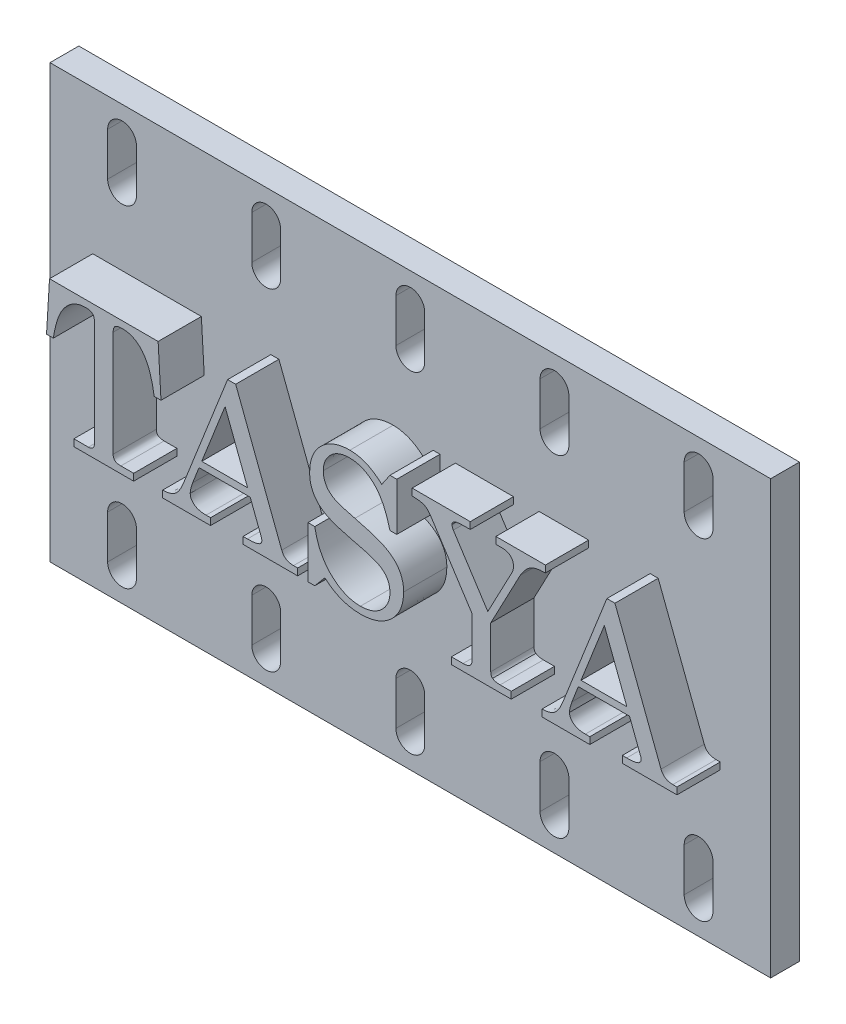
from build123d import *

# Parameters (mm, degrees)
BOSS_EXTRUDE1_DEPTH   = 5
BOSS_EXTRUDE1_2_DEPTH = 5
BOSS_EXTRUDE1_3_DEPTH = 5
BOSS_EXTRUDE1_4_DEPTH = 5
BOSS_EXTRUDE1_5_DEPTH = 5
SKETCH2_W             = 40
SKETCH2_H             = 30
SKETCH2_W_2           = 10
BOSS_EXTRUDE3_DEPTH   = 2


with BuildPart() as part:
    # Sketch1 → Boss-Extrude1 (new body)
    with BuildSketch(Plane.XY):
        with BuildLine():
            Line((0.563054481, 9.245947266), (8.097612469, 9.245947266))
            Line((8.097612469, 9.245947266), (8.297644982, 5.808351487))
            Line((8.297644982, 5.808351487), (7.82349384, 5.808351487))
            add(Edge.make_bspline(
                [(7.82349384, 5.808351487), (7.804678657, 5.928288889), (7.768184964, 6.160917972), (7.699525761, 6.497208977), (7.620929031, 6.810341913), (7.529276483, 7.099839675), (7.431316985, 7.367878699), (7.316901119, 7.61068071), (7.196164252, 7.832600129), (7.061512974, 8.029360895), (6.919724607, 8.206165501), (6.762593818, 8.355927576), (6.597562097, 8.4859884), (6.419534153, 8.589999112), (6.231530974, 8.672863723), (6.031936665, 8.729143406), (5.822705035, 8.766346551), (5.67948398, 8.769955966), (5.606466822, 8.771796124)],
                knots=[0, 0, 0, 0, 1.432451823, 2.778365615, 4.048814831, 5.240071754, 6.360497384, 7.41327137, 8.404638267, 9.338184166, 10.223433942, 11.073572704, 11.894005427, 12.697408972, 13.500019358, 14.311606187, 15.139220712, 16, 16, 16, 16], degree=3))
            add(Edge.make_bspline(
                [(5.606466822, 8.771796124), (5.551422442, 8.770775717), (5.449348164, 8.768883474), (5.309962879, 8.745657082), (5.197450782, 8.707931543), (5.109237715, 8.65324224), (5.04974781, 8.574384523), (5.006694504, 8.480445681), (4.983843545, 8.365344776), (4.980430993, 8.282916807), (4.978586989, 8.238376089)],
                knots=[0, 0, 0, 0, 1.373378458, 2.546792513, 3.512211499, 4.324574211, 5.092577234, 5.940998757, 6.88739958, 8, 8, 8, 8], degree=3))
            Line((4.978586989, 8.238376089), (4.978586989, 0.90755492))
            add(Edge.make_bspline(
                [(4.978586989, 0.90755492), (4.979584666, 0.87278867), (4.98146605, 0.807227662), (5.006700455, 0.716091594), (5.044666171, 0.638311598), (5.101751243, 0.575510306), (5.177731374, 0.528011848), (5.272770682, 0.496116679), (5.387268826, 0.478447341), (5.469340404, 0.475662011), (5.513859177, 0.474151142)],
                knots=[0, 0, 0, 0, 1.048245625, 1.976745847, 2.836833363, 3.643156965, 4.508094636, 5.517888877, 6.65360768, 8, 8, 8, 8], degree=3))
            Line((5.513859177, 0.474151142), (6.401040415, 0.474151142))
            Line((6.401040415, 0.474151142), (6.401040415, 0))
            Line((6.401040415, 0), (2.252217924, 0))
            Line((2.252217924, 0), (2.252217924, 0.474151142))
            Line((2.252217924, 0.474151142), (3.2597891, 0.474151142))
            add(Edge.make_bspline(
                [(3.2597891, 0.474151142), (3.291333974, 0.47581063), (3.351304235, 0.4789655), (3.436297414, 0.496064778), (3.508591021, 0.530665008), (3.569220959, 0.577139462), (3.614894413, 0.636186437), (3.652644955, 0.701331748), (3.669716188, 0.778343224), (3.672970092, 0.831570061), (3.674671349, 0.859398945)],
                knots=[0, 0, 0, 0, 1.182923075, 2.248866389, 3.221156285, 4.16015494, 5.08104171, 6.001928481, 6.955337164, 8, 8, 8, 8], degree=3))
            Line((3.674671349, 0.859398945), (3.674671349, 8.293940676))
            add(Edge.make_bspline(
                [(3.674671349, 8.293940676), (3.672887573, 8.331111829), (3.669508339, 8.401529872), (3.64437435, 8.501200162), (3.596476834, 8.584512438), (3.530886504, 8.654287232), (3.444955314, 8.708329401), (3.337982474, 8.747558728), (3.209319337, 8.76801486), (3.116621228, 8.770480606), (3.067165199, 8.771796124)],
                knots=[0, 0, 0, 0, 1.008377174, 1.910297138, 2.757863652, 3.587197201, 4.483814459, 5.485493234, 6.658467561, 8, 8, 8, 8], degree=3))
            add(Edge.make_bspline(
                [(3.067165199, 8.771796124), (2.992909126, 8.769375509), (2.846436994, 8.764600779), (2.631605136, 8.724507676), (2.426756058, 8.658910026), (2.229653173, 8.570067977), (2.044583616, 8.451254369), (1.866527989, 8.310246982), (1.701725931, 8.139513399), (1.601639785, 8.01269909), (1.550251975, 7.947588084)],
                knots=[0, 0, 0, 0, 0.991941037, 1.9566308, 2.909208852, 3.861929869, 4.837255463, 5.841206404, 6.891598091, 8, 8, 8, 8], degree=3))
            add(Edge.make_bspline(
                [(1.550251975, 7.947588084), (1.509077834, 7.887742158), (1.423557288, 7.763439472), (1.311171305, 7.55614498), (1.208096281, 7.3242563), (1.114033616, 7.067941852), (1.02906113, 6.787732222), (0.95425462, 6.483244295), (0.884639618, 6.154856125), (0.848469469, 5.926462556), (0.829764498, 5.808351487)],
                knots=[0, 0, 0, 0, 0.765022806, 1.588986829, 2.480046904, 3.437147945, 4.464044908, 5.563778044, 6.740136255, 8, 8, 8, 8], degree=3))
            Line((0.829764498, 5.808351487), (0.355613356, 5.808351487))
            Line((0.355613356, 5.808351487), (0.563054481, 9.245947266))
        make_face()
    extrude(amount=BOSS_EXTRUDE1_DEPTH)



with BuildPart() as body_2:
    # Sketch1 → Boss-Extrude1 2 (new body)
    with BuildSketch(Plane.XY):
        with BuildLine():
            Line((12.918766462, 9.364485051), (13.478116637, 9.364485051))
            Line((13.478116637, 9.364485051), (16.674932539, 0.992753953))
            add(Edge.make_bspline(
                [(16.674932539, 0.992753953), (16.692816406, 0.951346792), (16.727162006, 0.871825191), (16.798308338, 0.76529358), (16.880676758, 0.673468244), (16.979576467, 0.601464322), (17.088170253, 0.541206615), (17.212876463, 0.505101948), (17.348453682, 0.476659883), (17.444017206, 0.475007961), (17.493584119, 0.474151142)],
                knots=[0, 0, 0, 0, 1.039787226, 1.996889935, 2.945563617, 3.872445737, 4.810232727, 5.797866669, 6.857796924, 8, 8, 8, 8], degree=3))
            Line((17.493584119, 0.474151142), (17.780667819, 0.474151142))
            Line((17.780667819, 0.474151142), (17.780667819, 0))
            Line((17.780667819, 0), (13.987458684, 0))
            Line((13.987458684, 0), (13.987458684, 0.474151142))
            Line((13.987458684, 0.474151142), (14.289359606, 0.474151142))
            add(Edge.make_bspline(
                [(14.289359606, 0.474151142), (14.380842109, 0.475039176), (14.549978611, 0.47668101), (14.781309811, 0.501271302), (14.972466378, 0.534769329), (15.078899198, 0.579899665), (15.126532716, 0.600097539)],
                knots=[0, 0, 0, 0, 1.28614417, 2.377874675, 3.274025287, 4, 4, 4, 4], degree=3))
            add(Edge.make_bspline(
                [(15.126532716, 0.600097539), (15.151529903, 0.615553505), (15.200076981, 0.645570564), (15.256062281, 0.709776258), (15.286565121, 0.788460965), (15.290951955, 0.843715292), (15.293226477, 0.872364015)],
                knots=[0, 0, 0, 0, 1.044845995, 2.029197152, 2.978161746, 4, 4, 4, 4], degree=3))
            add(Edge.make_bspline(
                [(15.293226477, 0.872364015), (15.291206535, 0.90974201), (15.286982294, 0.987909472), (15.260658814, 1.061682477), (15.246922654, 1.100178821)],
                knots=[0, 0, 0, 0, 0.9563569, 2, 2, 2, 2], degree=3))
            Line((15.246922654, 1.100178821), (14.487539966, 3.081982422))
            Line((14.487539966, 3.081982422), (10.936962861, 3.081982422))
            Line((10.936962861, 3.081982422), (10.490594013, 1.944760543))
            add(Edge.make_bspline(
                [(10.490594013, 1.944760543), (10.465604863, 1.87342624), (10.418820652, 1.739875513), (10.366585704, 1.54819676), (10.332269029, 1.379822279), (10.32652917, 1.274406703), (10.323900252, 1.226125218)],
                knots=[0, 0, 0, 0, 1.224040328, 2.291625076, 3.217545626, 4, 4, 4, 4], degree=3))
            add(Edge.make_bspline(
                [(10.323900252, 1.226125218), (10.327569672, 1.175652974), (10.334796345, 1.076251309), (10.390182519, 0.933093845), (10.48233579, 0.804616072), (10.605479898, 0.68621891), (10.765051719, 0.589693692), (10.958064524, 0.52283246), (11.181360639, 0.47917018), (11.341115014, 0.475891726), (11.425931226, 0.474151142)],
                knots=[0, 0, 0, 0, 0.81354721, 1.602226087, 2.440081589, 3.349586742, 4.342853265, 5.424428202, 6.632586778, 8, 8, 8, 8], degree=3))
            Line((11.425931226, 0.474151142), (11.73524076, 0.474151142))
            Line((11.73524076, 0.474151142), (11.73524076, 0))
            Line((11.73524076, 0), (8.416182767, 0))
            Line((8.416182767, 0), (8.416182767, 0.474151142))
            add(Edge.make_bspline(
                [(8.416182767, 0.474151142), (8.502216342, 0.476678872), (8.666294475, 0.481499609), (8.898712724, 0.526244937), (9.103803578, 0.599287443), (9.284934005, 0.707490069), (9.446987224, 0.859943749), (9.591857232, 1.064419414), (9.73657869, 1.316731177), (9.816222342, 1.508400909), (9.859009875, 1.611373021)],
                knots=[0, 0, 0, 0, 1.036060294, 1.975912788, 2.839911673, 3.647735987, 4.500737518, 5.500873586, 6.657376306, 8, 8, 8, 8], degree=3))
            Line((9.859009875, 1.611373021), (12.918766462, 9.364485051))
        make_face()
        Polygon((12.742811937, 7.656800079), (11.124030304, 3.556133564), (14.306028982, 3.556133564), align=None, mode=Mode.SUBTRACT)
    extrude(amount=BOSS_EXTRUDE1_2_DEPTH)


with BuildPart() as body_3:
    # Sketch1 → Boss-Extrude1 3 (new body)
    with BuildSketch(Plane.XY):
        with BuildLine():
            Line((23.614949446, 8.416182767), (24.181708233, 9.245947266))
            Line((24.181708233, 9.245947266), (24.655859375, 9.245947266))
            Line((24.655859375, 9.245947266), (24.655859375, 5.926889273))
            Line((24.655859375, 5.926889273), (24.181708233, 5.926889273))
            add(Edge.make_bspline(
                [(24.181708233, 5.926889273), (24.149549446, 6.051313411), (24.086898319, 6.293714109), (23.976066142, 6.641338116), (23.853931269, 6.963011493), (23.720908877, 7.258406813), (23.576468011, 7.52785254), (23.421255834, 7.772361036), (23.25224955, 7.98916577), (23.073905752, 8.181558926), (22.885765585, 8.348472793), (22.691494244, 8.494503936), (22.487960952, 8.614433236), (22.279884109, 8.716079365), (22.063769589, 8.794150511), (21.840370034, 8.849667598), (21.610135525, 8.884042204), (21.454222126, 8.888226497), (21.375696593, 8.890333909)],
                knots=[0, 0, 0, 0, 1.392564724, 2.712967664, 3.951873449, 5.119722724, 6.221370984, 7.262600271, 8.254348041, 9.196438926, 10.101595302, 10.976777585, 11.825919055, 12.65785703, 13.483312273, 14.310934069, 15.149304651, 16, 16, 16, 16], degree=3))
            add(Edge.make_bspline(
                [(21.375696593, 8.890333909), (21.310818969, 8.888892428), (21.183141876, 8.886055638), (20.996285608, 8.864319488), (20.818603967, 8.824546884), (20.649717038, 8.771272175), (20.489688263, 8.702329108), (20.338230058, 8.61890302), (20.197368306, 8.517951672), (20.066405298, 8.403874925), (19.948972535, 8.278298108), (19.844174946, 8.146191526), (19.754622938, 8.007902937), (19.683965702, 7.86123418), (19.628087802, 7.708612396), (19.587334927, 7.549251878), (19.562380201, 7.38285588), (19.559963627, 7.269787787), (19.5587346, 7.212283384)],
                knots=[0, 0, 0, 0, 1.126750777, 2.217409579, 3.260704063, 4.284866151, 5.288787342, 6.282404548, 7.282136379, 8.292906458, 9.294247238, 10.263909872, 11.218754854, 12.149141496, 13.085441672, 14.037331684, 15.001822113, 16, 16, 16, 16], degree=3))
            add(Edge.make_bspline(
                [(19.5587346, 7.212283384), (19.560338986, 7.141079707), (19.563459938, 7.002569821), (19.603170347, 6.801969165), (19.660893552, 6.613771619), (19.745402063, 6.439709686), (19.853314318, 6.280563624), (19.987771364, 6.138545977), (20.14370181, 6.010668326), (20.293478654, 5.916679454), (20.432819374, 5.849180042), (20.559515408, 5.795363538), (20.70752379, 5.740722512), (20.87578847, 5.682793566), (21.065603734, 5.626888572), (21.274754603, 5.564261273), (21.506224141, 5.504399577), (21.667686163, 5.464325253), (21.751683631, 5.443477367)],
                knots=[0, 0, 0, 0, 1.100069853, 2.139925311, 3.152029683, 4.138980986, 5.121994753, 6.115535174, 7.15398554, 8.235440347, 8.84210157, 9.54830075, 10.364495047, 11.282859591, 12.301255968, 13.425815379, 14.660830642, 16, 16, 16, 16], degree=3))
            add(Edge.make_bspline(
                [(21.751683631, 5.443477367), (21.870292144, 5.413504481), (22.099251553, 5.355645446), (22.428777974, 5.267580529), (22.731863344, 5.178206836), (23.00859859, 5.090084094), (23.259712825, 5.002338594), (23.485398177, 4.918677374), (23.684586716, 4.833606349), (23.910566111, 4.721489514), (24.161142465, 4.576128058), (24.421474284, 4.373746219), (24.643253834, 4.151345151), (24.820861216, 3.903380658), (24.959356189, 3.634935073), (25.061005649, 3.345562017), (25.117978365, 3.03234719), (25.125927824, 2.81673152), (25.130010517, 2.705995384)],
                knots=[0, 0, 0, 0, 1.232165093, 2.378545896, 3.435149422, 4.414474693, 5.303353997, 6.114110724, 6.838339871, 7.483508315, 8.654450536, 9.749016275, 10.7955263, 11.806804694, 12.808015395, 13.828656267, 14.884838868, 16, 16, 16, 16], degree=3))
            add(Edge.make_bspline(
                [(25.130010517, 2.705995384), (25.127635891, 2.606458627), (25.122971026, 2.410922361), (25.082777985, 2.124410697), (25.01907061, 1.850175585), (24.924816854, 1.590305684), (24.80868548, 1.341419907), (24.662378204, 1.10810057), (24.493223766, 0.885470899), (24.297753378, 0.67987925), (24.08170221, 0.493327418), (23.849063451, 0.329501154), (23.601863707, 0.18972636), (23.338710279, 0.075818658), (23.059577717, -0.010414045), (22.765924515, -0.073729015), (22.457074502, -0.110937569), (22.246309011, -0.115970271), (22.138783587, -0.118537785)],
                knots=[0, 0, 0, 0, 1.035674451, 2.034544032, 3.00567608, 3.961072093, 4.906865893, 5.859230957, 6.821991021, 7.813035652, 8.806369794, 9.78881277, 10.770098954, 11.757427494, 12.767644959, 13.806306077, 14.880851562, 16, 16, 16, 16], degree=3))
            add(Edge.make_bspline(
                [(22.138783587, -0.118537785), (22.021945604, -0.115814077), (21.791724477, -0.110447199), (21.452063176, -0.064101218), (21.124320046, 0.008701429), (20.808398165, 0.114166107), (20.504014556, 0.2470689), (20.211972029, 0.411885647), (19.930264259, 0.604339511), (19.756189048, 0.753969664), (19.668011621, 0.829764498)],
                knots=[0, 0, 0, 0, 1.034489663, 2.038389989, 3.030740084, 4.004349409, 4.983823211, 5.968063708, 6.970727015, 8, 8, 8, 8], degree=3))
            Line((19.668011621, 0.829764498), (18.966045673, 0))
            Line((18.966045673, 0), (18.491894531, 0))
            Line((18.491894531, 0), (18.491894531, 3.556133564))
            Line((18.491894531, 3.556133564), (18.966045673, 3.556133564))
            add(Edge.make_bspline(
                [(18.966045673, 3.556133564), (18.988950223, 3.435333902), (19.033824649, 3.198664097), (19.130286233, 2.857050395), (19.241769563, 2.532862623), (19.377645142, 2.229334555), (19.531403711, 1.944863159), (19.704283433, 1.67934409), (19.899167407, 1.435136421), (20.112008489, 1.211074679), (20.338109476, 1.010988087), (20.572185926, 0.835095404), (20.814739316, 0.687372795), (21.064632713, 0.567850293), (21.320559637, 0.470751953), (21.584886047, 0.405394706), (21.855848082, 0.362438537), (22.039220458, 0.357896151), (22.131374975, 0.355613356)],
                knots=[0, 0, 0, 0, 1.203557391, 2.358000753, 3.472814881, 4.558186921, 5.610607053, 6.636911962, 7.656713516, 8.666011679, 9.659686897, 10.610151865, 11.529909132, 12.435830157, 13.319692086, 14.205413257, 15.098123285, 16, 16, 16, 16], degree=3))
            add(Edge.make_bspline(
                [(22.131374975, 0.355613356), (22.204895348, 0.357686079), (22.349240977, 0.361755541), (22.560867965, 0.385013118), (22.762191003, 0.428284581), (22.953278345, 0.487325132), (23.134641819, 0.562882689), (23.303176375, 0.659190806), (23.464339311, 0.767773875), (23.610631342, 0.895558005), (23.743618451, 1.033995108), (23.861327203, 1.18022388), (23.95975783, 1.335322064), (24.042168201, 1.496782917), (24.10542087, 1.666458676), (24.149697884, 1.84288149), (24.176228238, 2.026686057), (24.179856874, 2.151495904), (24.181708233, 2.215174866)],
                knots=[0, 0, 0, 0, 1.141184085, 2.24053454, 3.298523207, 4.331930668, 5.340931447, 6.340425213, 7.339689331, 8.351914852, 9.348050511, 10.316191482, 11.259745609, 12.193863714, 13.124634419, 14.063457944, 15.01196107, 16, 16, 16, 16], degree=3))
            add(Edge.make_bspline(
                [(24.181708233, 2.215174866), (24.179312846, 2.286350324), (24.174629979, 2.425494919), (24.135117648, 2.627896683), (24.068144239, 2.816353683), (23.974127308, 2.991431475), (23.852302737, 3.152518278), (23.699587737, 3.299262508), (23.513696211, 3.427668366), (23.335610815, 3.52473323), (23.168481925, 3.59989283), (23.012391396, 3.658470983), (22.829005392, 3.718541837), (22.618595512, 3.783892967), (22.380871958, 3.851910766), (22.114528609, 3.922094349), (21.821396532, 3.996184081), (21.615939651, 4.044199897), (21.509051602, 4.069179916)],
                knots=[0, 0, 0, 0, 0.958725222, 1.874261679, 2.766509533, 3.645150004, 4.542196588, 5.477931134, 6.486874257, 7.578017349, 8.207475951, 8.95547135, 9.823846098, 10.80822927, 11.924964205, 13.156213188, 14.52053228, 16, 16, 16, 16], degree=3))
            add(Edge.make_bspline(
                [(21.509051602, 4.069179916), (21.39097436, 4.098206562), (21.163360847, 4.154160247), (20.836449388, 4.244952999), (20.53648267, 4.338490912), (20.264295775, 4.436911894), (20.018682806, 4.535750654), (19.802046187, 4.639837522), (19.610602823, 4.744040542), (19.497626276, 4.822661563), (19.443901121, 4.860049204)],
                knots=[0, 0, 0, 0, 1.311989861, 2.529078561, 3.660524616, 4.701531557, 5.651641921, 6.51576602, 7.294183583, 8, 8, 8, 8], degree=3))
            add(Edge.make_bspline(
                [(19.443901121, 4.860049204), (19.377723779, 4.913497057), (19.246920687, 5.019139626), (19.076603944, 5.201691173), (18.93121092, 5.400195845), (18.815493896, 5.616749193), (18.720852388, 5.847661374), (18.657280396, 6.096364698), (18.617303896, 6.360841816), (18.612761977, 6.542887949), (18.610432317, 6.636263833)],
                knots=[0, 0, 0, 0, 1.000126293, 1.976803651, 2.928762077, 3.887903112, 4.859377268, 5.858658592, 6.90165398, 8, 8, 8, 8], degree=3))
            add(Edge.make_bspline(
                [(18.610432317, 6.636263833), (18.613176371, 6.733904921), (18.618560996, 6.925504872), (18.653334434, 7.206104239), (18.714821263, 7.473603328), (18.801816216, 7.726569659), (18.912147344, 7.967144289), (19.047490954, 8.193244556), (19.208377824, 8.405567047), (19.391035194, 8.603250202), (19.593606802, 8.781658934), (19.811265136, 8.938211929), (20.042541471, 9.070979292), (20.288026859, 9.178239051), (20.547304163, 9.262446022), (20.820533113, 9.320173935), (21.106613312, 9.359480525), (21.302090691, 9.362796549), (21.401626734, 9.364485051)],
                knots=[0, 0, 0, 0, 1.070268323, 2.100174846, 3.093319402, 4.073467769, 5.027260625, 5.989371598, 6.955733259, 7.942215445, 8.934691163, 9.909381139, 10.876334984, 11.8520346, 12.840742565, 13.858820071, 14.909722553, 16, 16, 16, 16], degree=3))
            add(Edge.make_bspline(
                [(21.401626734, 9.364485051), (21.498705755, 9.362211753), (21.690657213, 9.357716827), (21.974821865, 9.315106006), (22.251582377, 9.246795345), (22.523711967, 9.149358581), (22.793673969, 9.0186928), (23.06722736, 8.855034263), (23.343148462, 8.651353383), (23.5221539, 8.496472343), (23.614949446, 8.416182767)],
                knots=[0, 0, 0, 0, 0.943425551, 1.865407251, 2.787037101, 3.711770321, 4.670334693, 5.698831597, 6.80708552, 8, 8, 8, 8], degree=3))
        make_face()
    extrude(amount=BOSS_EXTRUDE1_3_DEPTH)


with BuildPart() as body_4:
    # Sketch1 → Boss-Extrude1 4 (new body)
    with BuildSketch(Plane.XY):
        with BuildLine():
            Line((25.722699444, 9.245947266), (29.75298415, 9.245947266))
            Line((29.75298415, 9.245947266), (29.75298415, 8.771796124))
            Line((29.75298415, 8.771796124), (29.334397595, 8.771796124))
            add(Edge.make_bspline(
                [(29.334397595, 8.771796124), (29.254695131, 8.771097723), (29.110513694, 8.769834318), (28.91695931, 8.752863508), (28.766583365, 8.731085444), (28.65678943, 8.692305318), (28.581021402, 8.641858478), (28.530514017, 8.583174664), (28.495503013, 8.516637239), (28.49296134, 8.467245537), (28.491668026, 8.442112908)],
                knots=[0, 0, 0, 0, 1.913714744, 3.461902253, 4.666412246, 5.553424366, 6.236294336, 6.825067748, 7.40214376, 8, 8, 8, 8], degree=3))
            add(Edge.make_bspline(
                [(28.491668026, 8.442112908), (28.495431124, 8.389781725), (28.502908037, 8.28580468), (28.553560105, 8.194716604), (28.578719212, 8.14947275)],
                knots=[0, 0, 0, 0, 1.006591081, 2, 2, 2, 2], degree=3))
            Line((28.578719212, 8.14947275), (30.971700756, 4.452575566))
            Line((30.971700756, 4.452575566), (32.640490517, 7.614200563))
            add(Edge.make_bspline(
                [(32.640490517, 7.614200563), (32.658148083, 7.648967604), (32.69315875, 7.71790221), (32.728275015, 7.829063177), (32.748819797, 7.944346497), (32.751911782, 8.022825139), (32.753471844, 8.062421564)],
                knots=[0, 0, 0, 0, 1.000544011, 1.983835969, 2.982743766, 4, 4, 4, 4], degree=3))
            add(Edge.make_bspline(
                [(32.753471844, 8.062421564), (32.751209429, 8.113930675), (32.74685769, 8.213008092), (32.706881751, 8.354235056), (32.639450456, 8.478074809), (32.546200252, 8.583798873), (32.430561477, 8.670910166), (32.288978001, 8.728977541), (32.127647836, 8.767512029), (32.012248823, 8.770318486), (31.951489639, 8.771796124)],
                knots=[0, 0, 0, 0, 1.018724209, 1.959508948, 2.878985283, 3.789059353, 4.733256338, 5.719300026, 6.799179769, 8, 8, 8, 8], degree=3))
            Line((31.951489639, 8.771796124), (31.531050931, 8.771796124))
            Line((31.531050931, 8.771796124), (31.531050931, 9.245947266))
            Line((31.531050931, 9.245947266), (34.96864671, 9.245947266))
            Line((34.96864671, 9.245947266), (34.96864671, 8.771796124))
            add(Edge.make_bspline(
                [(34.96864671, 8.771796124), (34.866654762, 8.769539507), (34.672957235, 8.765253865), (34.398455626, 8.727252086), (34.157597817, 8.661611814), (33.943619952, 8.566976414), (33.752455486, 8.430065456), (33.569081649, 8.251980476), (33.390516395, 8.027143054), (33.283842758, 7.85496647), (33.227622986, 7.764224947)],
                knots=[0, 0, 0, 0, 1.144733651, 2.174015535, 3.102350986, 3.939892726, 4.785995591, 5.727257514, 6.802205801, 8, 8, 8, 8], degree=3))
            Line((33.227622986, 7.764224947), (31.175437575, 3.874703862))
            Line((31.175437575, 3.874703862), (31.175437575, 0.939041519))
            add(Edge.make_bspline(
                [(31.175437575, 0.939041519), (31.176559879, 0.903085597), (31.178679485, 0.835178535), (31.202090372, 0.741274791), (31.243572861, 0.663023105), (31.283614891, 0.624520761), (31.303236125, 0.605653998)],
                knots=[0, 0, 0, 0, 1.166754949, 2.203556381, 3.119713918, 4, 4, 4, 4], degree=3))
            add(Edge.make_bspline(
                [(31.303236125, 0.605653998), (31.335230474, 0.585007574), (31.402982306, 0.54128632), (31.526595947, 0.503913468), (31.668707009, 0.476343015), (31.771034385, 0.474912933), (31.825543242, 0.474151142)],
                knots=[0, 0, 0, 0, 0.831441795, 1.760676714, 2.807132964, 4, 4, 4, 4], degree=3))
            Line((31.825543242, 0.474151142), (32.597891001, 0.474151142))
            Line((32.597891001, 0.474151142), (32.597891001, 0))
            Line((32.597891001, 0), (28.44906851, 0))
            Line((28.44906851, 0), (28.44906851, 0.474151142))
            Line((28.44906851, 0.474151142), (29.256607173, 0.474151142))
            add(Edge.make_bspline(
                [(29.256607173, 0.474151142), (29.307377237, 0.475097898), (29.402176311, 0.476865705), (29.532224009, 0.501534187), (29.641737793, 0.53664314), (29.72773186, 0.591806361), (29.792778395, 0.66112113), (29.840879488, 0.742251097), (29.866111884, 0.837581043), (29.86967141, 0.904336652), (29.871521935, 0.939041519)],
                knots=[0, 0, 0, 0, 1.38374589, 2.583763285, 3.601916947, 4.50424506, 5.338860912, 6.1772126, 7.052370344, 8, 8, 8, 8], degree=3))
            Line((29.871521935, 0.939041519), (29.871521935, 3.793209135))
            Line((29.871521935, 3.793209135), (26.991424179, 8.242080395))
            add(Edge.make_bspline(
                [(26.991424179, 8.242080395), (26.95971986, 8.287304298), (26.898910745, 8.374044072), (26.79427043, 8.487667193), (26.679865165, 8.577206588), (26.553598119, 8.650275831), (26.400758146, 8.703529277), (26.211557315, 8.737018557), (25.981430538, 8.763227718), (25.813548081, 8.768787487), (25.722699444, 8.771796124)],
                knots=[0, 0, 0, 0, 0.914989527, 1.754956588, 2.549357515, 3.314817421, 4.162974635, 5.216717468, 6.493842491, 8, 8, 8, 8], degree=3))
            Line((25.722699444, 8.771796124), (25.722699444, 9.245947266))
        make_face()
    extrude(amount=BOSS_EXTRUDE1_4_DEPTH)


with BuildPart() as body_5:
    # Sketch1 → Boss-Extrude1 5 (new body)
    with BuildSketch(Plane.XY):
        with BuildLine():
            Line((39.234154833, 9.364485051), (39.793505008, 9.364485051))
            Line((39.793505008, 9.364485051), (42.99032091, 0.992753953))
            add(Edge.make_bspline(
                [(42.99032091, 0.992753953), (43.008204778, 0.951346792), (43.042550378, 0.871825191), (43.11369671, 0.76529358), (43.196065129, 0.673468244), (43.294964838, 0.601464322), (43.403558624, 0.541206615), (43.528264835, 0.505101948), (43.663842054, 0.476659883), (43.759405578, 0.475007961), (43.808972491, 0.474151142)],
                knots=[0, 0, 0, 0, 1.039787226, 1.996889935, 2.945563617, 3.872445737, 4.810232727, 5.797866669, 6.857796924, 8, 8, 8, 8], degree=3))
            Line((43.808972491, 0.474151142), (44.09605619, 0.474151142))
            Line((44.09605619, 0.474151142), (44.09605619, 0))
            Line((44.09605619, 0), (40.302847055, 0))
            Line((40.302847055, 0), (40.302847055, 0.474151142))
            Line((40.302847055, 0.474151142), (40.604747978, 0.474151142))
            add(Edge.make_bspline(
                [(40.604747978, 0.474151142), (40.69623048, 0.475039176), (40.865366982, 0.47668101), (41.096698182, 0.501271302), (41.287854749, 0.534769329), (41.394287569, 0.579899665), (41.441921087, 0.600097539)],
                knots=[0, 0, 0, 0, 1.28614417, 2.377874675, 3.274025287, 4, 4, 4, 4], degree=3))
            add(Edge.make_bspline(
                [(41.441921087, 0.600097539), (41.466918274, 0.615553505), (41.515465353, 0.645570564), (41.571450653, 0.709776258), (41.601953493, 0.788460965), (41.606340326, 0.843715292), (41.608614848, 0.872364015)],
                knots=[0, 0, 0, 0, 1.044845995, 2.029197152, 2.978161746, 4, 4, 4, 4], degree=3))
            add(Edge.make_bspline(
                [(41.608614848, 0.872364015), (41.606594907, 0.90974201), (41.602370665, 0.987909472), (41.576047185, 1.061682477), (41.562311026, 1.100178821)],
                knots=[0, 0, 0, 0, 0.9563569, 2, 2, 2, 2], degree=3))
            Line((41.562311026, 1.100178821), (40.802928338, 3.081982422))
            Line((40.802928338, 3.081982422), (37.252351233, 3.081982422))
            Line((37.252351233, 3.081982422), (36.805982384, 1.944760543))
            add(Edge.make_bspline(
                [(36.805982384, 1.944760543), (36.780993235, 1.87342624), (36.734209023, 1.739875513), (36.681974075, 1.54819676), (36.6476574, 1.379822279), (36.641917542, 1.274406703), (36.639288624, 1.226125218)],
                knots=[0, 0, 0, 0, 1.224040328, 2.291625076, 3.217545626, 4, 4, 4, 4], degree=3))
            add(Edge.make_bspline(
                [(36.639288624, 1.226125218), (36.642958043, 1.175652974), (36.650184717, 1.076251309), (36.705570891, 0.933093845), (36.797724161, 0.804616072), (36.92086827, 0.68621891), (37.08044009, 0.589693692), (37.273452896, 0.52283246), (37.496749011, 0.47917018), (37.656503385, 0.475891726), (37.741319598, 0.474151142)],
                knots=[0, 0, 0, 0, 0.81354721, 1.602226087, 2.440081589, 3.349586742, 4.342853265, 5.424428202, 6.632586778, 8, 8, 8, 8], degree=3))
            Line((37.741319598, 0.474151142), (38.050629132, 0.474151142))
            Line((38.050629132, 0.474151142), (38.050629132, 0))
            Line((38.050629132, 0), (34.731571139, 0))
            Line((34.731571139, 0), (34.731571139, 0.474151142))
            add(Edge.make_bspline(
                [(34.731571139, 0.474151142), (34.817604713, 0.476678872), (34.981682847, 0.481499609), (35.214101095, 0.526244937), (35.419191949, 0.599287443), (35.600322377, 0.707490069), (35.762375596, 0.859943749), (35.907245603, 1.064419414), (36.051967061, 1.316731177), (36.131610713, 1.508400909), (36.174398246, 1.611373021)],
                knots=[0, 0, 0, 0, 1.036060294, 1.975912788, 2.839911673, 3.647735987, 4.500737518, 5.500873586, 6.657376306, 8, 8, 8, 8], degree=3))
            Line((36.174398246, 1.611373021), (39.234154833, 9.364485051))
        make_face()
        Polygon((39.058200308, 7.656800079), (37.439418675, 3.556133564), (40.621417354, 3.556133564), align=None, mode=Mode.SUBTRACT)
    extrude(amount=BOSS_EXTRUDE1_5_DEPTH)


with BuildPart() as part_1:
    add(part.part)

    add(body_2.part)  # Boss-Extrude3 merges body 2

    add(body_3.part)  # Boss-Extrude3 merges body 3

    add(body_4.part)  # Boss-Extrude3 merges body 4

    add(body_5.part)  # Boss-Extrude3 merges body 5
    # Sketch2 → Boss-Extrude3 (add)
    # profile 1 of 2: a face of its own
    with BuildSketch(Plane.XY):
        with Locations((17.59605619, 4.245947266)):
            Rectangle(SKETCH2_W, SKETCH2_H)
        with BuildLine():
            Line((3.59605619, -5.754052734), (3.59605619, -8.754052734))
            ThreePointArc((3.59605619, -8.754052734), (2.59605619, -9.754052734), (1.59605619, -8.754052734))
            Line((1.59605619, -8.754052734), (1.59605619, -5.754052734))
            ThreePointArc((1.59605619, -5.754052734), (2.59605619, -4.754052734), (3.59605619, -5.754052734))
        make_face(mode=Mode.SUBTRACT)
        with BuildLine():
            ThreePointArc((13.59605619, -8.754052734), (12.59605619, -9.754052734), (11.59605619, -8.754052734))
            Line((11.59605619, -8.754052734), (11.59605619, -5.754052734))
            ThreePointArc((11.59605619, -5.754052734), (12.59605619, -4.754052734), (13.59605619, -5.754052734))
            Line((13.59605619, -5.754052734), (13.59605619, -8.754052734))
        make_face(mode=Mode.SUBTRACT)
        with BuildLine():
            Line((23.59605619, -5.754052734), (23.59605619, -8.754052734))
            ThreePointArc((23.59605619, -8.754052734), (22.59605619, -9.754052734), (21.59605619, -8.754052734))
            Line((21.59605619, -8.754052734), (21.59605619, -5.754052734))
            ThreePointArc((21.59605619, -5.754052734), (22.59605619, -4.754052734), (23.59605619, -5.754052734))
        make_face(mode=Mode.SUBTRACT)
        with BuildLine():
            ThreePointArc((33.59605619, -8.754052734), (32.59605619, -9.754052734), (31.59605619, -8.754052734))
            Line((31.59605619, -8.754052734), (31.59605619, -5.754052734))
            ThreePointArc((31.59605619, -5.754052734), (32.59605619, -4.754052734), (33.59605619, -5.754052734))
            Line((33.59605619, -5.754052734), (33.59605619, -8.754052734))
        make_face(mode=Mode.SUBTRACT)
        with BuildLine():
            ThreePointArc((1.59605619, 17.245947266), (2.59605619, 18.245947266), (3.59605619, 17.245947266))
            Line((3.59605619, 17.245947266), (3.59605619, 14.245947266))
            ThreePointArc((3.59605619, 14.245947266), (2.59605619, 13.245947266), (1.59605619, 14.245947266))
            Line((1.59605619, 14.245947266), (1.59605619, 17.245947266))
        make_face(mode=Mode.SUBTRACT)
        with BuildLine():
            Line((11.59605619, 14.245947266), (11.59605619, 17.245947266))
            ThreePointArc((11.59605619, 17.245947266), (12.59605619, 18.245947266), (13.59605619, 17.245947266))
            Line((13.59605619, 17.245947266), (13.59605619, 14.245947266))
            ThreePointArc((13.59605619, 14.245947266), (12.59605619, 13.245947266), (11.59605619, 14.245947266))
        make_face(mode=Mode.SUBTRACT)
        with BuildLine():
            ThreePointArc((21.59605619, 17.245947266), (22.59605619, 18.245947266), (23.59605619, 17.245947266))
            Line((23.59605619, 17.245947266), (23.59605619, 14.245947266))
            ThreePointArc((23.59605619, 14.245947266), (22.59605619, 13.245947266), (21.59605619, 14.245947266))
            Line((21.59605619, 14.245947266), (21.59605619, 17.245947266))
        make_face(mode=Mode.SUBTRACT)
        with BuildLine():
            Line((31.59605619, 14.245947266), (31.59605619, 17.245947266))
            ThreePointArc((31.59605619, 17.245947266), (32.59605619, 18.245947266), (33.59605619, 17.245947266))
            Line((33.59605619, 17.245947266), (33.59605619, 14.245947266))
            ThreePointArc((33.59605619, 14.245947266), (32.59605619, 13.245947266), (31.59605619, 14.245947266))
        make_face(mode=Mode.SUBTRACT)
    # profile 2 of 2: a face of its own
    with BuildSketch(Plane.XY):
        with Locations((42.59605619, 4.245947266)):
            Rectangle(SKETCH2_W_2, SKETCH2_H)
        with BuildLine():
            Line((43.59605619, -5.754052734), (43.59605619, -8.754052734))
            ThreePointArc((43.59605619, -8.754052734), (42.59605619, -9.754052734), (41.59605619, -8.754052734))
            Line((41.59605619, -8.754052734), (41.59605619, -5.754052734))
            ThreePointArc((41.59605619, -5.754052734), (42.59605619, -4.754052734), (43.59605619, -5.754052734))
        make_face(mode=Mode.SUBTRACT)
        with BuildLine():
            ThreePointArc((41.59605619, 17.245947266), (42.59605619, 18.245947266), (43.59605619, 17.245947266))
            Line((43.59605619, 17.245947266), (43.59605619, 14.245947266))
            ThreePointArc((43.59605619, 14.245947266), (42.59605619, 13.245947266), (41.59605619, 14.245947266))
            Line((41.59605619, 14.245947266), (41.59605619, 17.245947266))
        make_face(mode=Mode.SUBTRACT)
    extrude(amount=BOSS_EXTRUDE3_DEPTH)


solid = part_1.part
